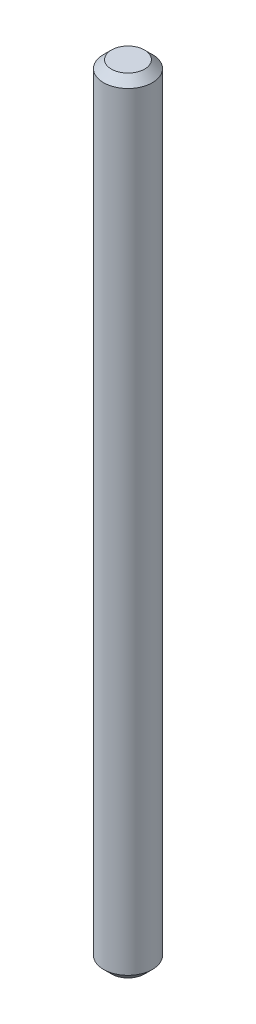
from build123d import *


with BuildPart() as part:
    # Sketch1 → Revolve1 (revolve)
    with BuildSketch(Plane(origin=(0, 0, 0), x_dir=(-1, 0, 0), z_dir=(0, 0, -1)), mode=Mode.PRIVATE) as revolve1_sk:
        Polygon((-1.07569, 0), (0, 0), (0, 50.8), (-1.07569, 50.8), (-1.58369, 50.292), (-1.58369, 0.508), align=None)
    revolve(revolve1_sk.sketch.rotate(Axis((0, 0, 0), (0, 1, 0)), 180), axis=Axis((0, 0, 0), (0, 1, 0)))


solid = part.part
